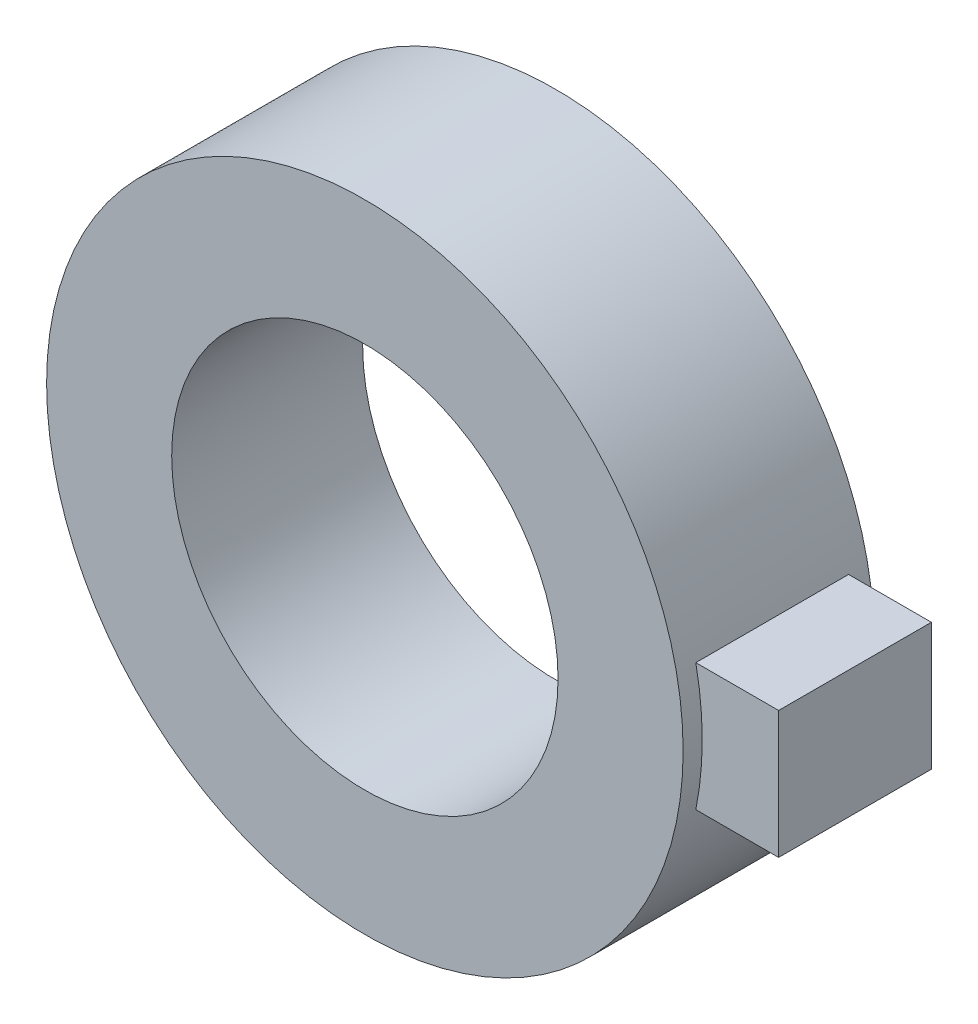
from build123d import *

# Parameters (mm, degrees)
EXTRUDE_SKETCH_1_R   = 50
EXTRUDE_SKETCH_1_R_2 = 30.35
EXTRUDE_1_DEPTH      = 30
EXTRUDE_START        = 3
EXTRUDE_SKETCH_2_W   = 16
EXTRUDE_SKETCH_2_H   = 20
EXTRUDE_2_DEPTH      = 24


with BuildPart() as part:
    # Extrude sketch 1 → Extrude 1 (new body)
    with BuildSketch(Plane.XY):
        Circle(EXTRUDE_SKETCH_1_R)
        Circle(EXTRUDE_SKETCH_1_R_2, mode=Mode.SUBTRACT)
    extrude(amount=EXTRUDE_1_DEPTH)


with BuildPart() as body_2:
    # Extrude sketch 2 → Extrude 2 (new body)
    with BuildSketch(Plane.XY.offset(EXTRUDE_START)):
        with Locations((54, 0)):
            Rectangle(EXTRUDE_SKETCH_2_W, EXTRUDE_SKETCH_2_H)
    extrude(amount=EXTRUDE_2_DEPTH)

    # Combine (weld / assembly of features): union part
    add(part.part)


solid = body_2.part
